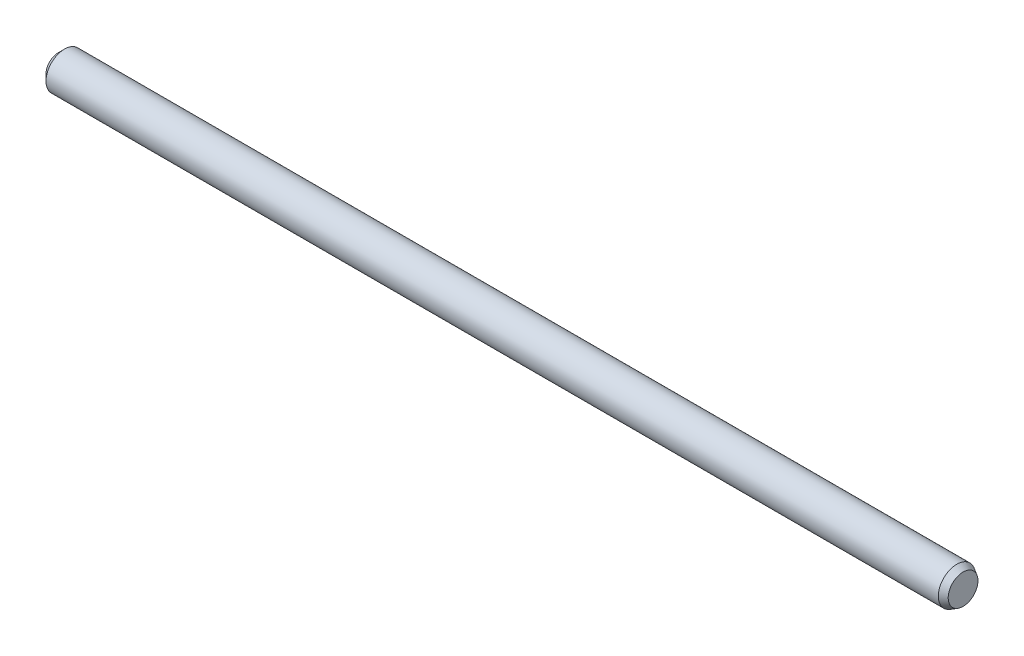
from build123d import *

# Parameters (mm, degrees)
CROQUIS1_R              = 1.475
SALIENTE_EXTRUIR1_DEPTH = 72
CHAFL_N1_SIZE           = 0.5
CHAFL_N1_SIZE2          = 0.288675135
CHAFL_N2_SIZE           = 0.5


with BuildPart() as part:
    # Croquis1 → Saliente-Extruir1 (new body)
    with BuildSketch(Plane(origin=(0, 0, 0), x_dir=(0, 0, -1), z_dir=(1, 0, 0))):
        Circle(CROQUIS1_R)
    extrude(amount=SALIENTE_EXTRUIR1_DEPTH)

    # Chaflán1
    chafl_n1_edges = [part.edges().sort_by_distance(p)[0] for p in [
        (72, 0, 1.475),
    ]]
    chafl_n1_side = [part.faces().sort_by_distance(p)[0] for p in [
        (36, 0, 1.475),
    ]]
    chamfer(chafl_n1_edges, length=CHAFL_N1_SIZE, length2=CHAFL_N1_SIZE2, reference=chafl_n1_side[0])

    # Chaflán2
    chafl_n2_edges = [part.edges().sort_by_distance(p)[0] for p in [
        (0, 0, 1.475),
    ]]
    chamfer(chafl_n2_edges, length=CHAFL_N2_SIZE)


solid = part.part
